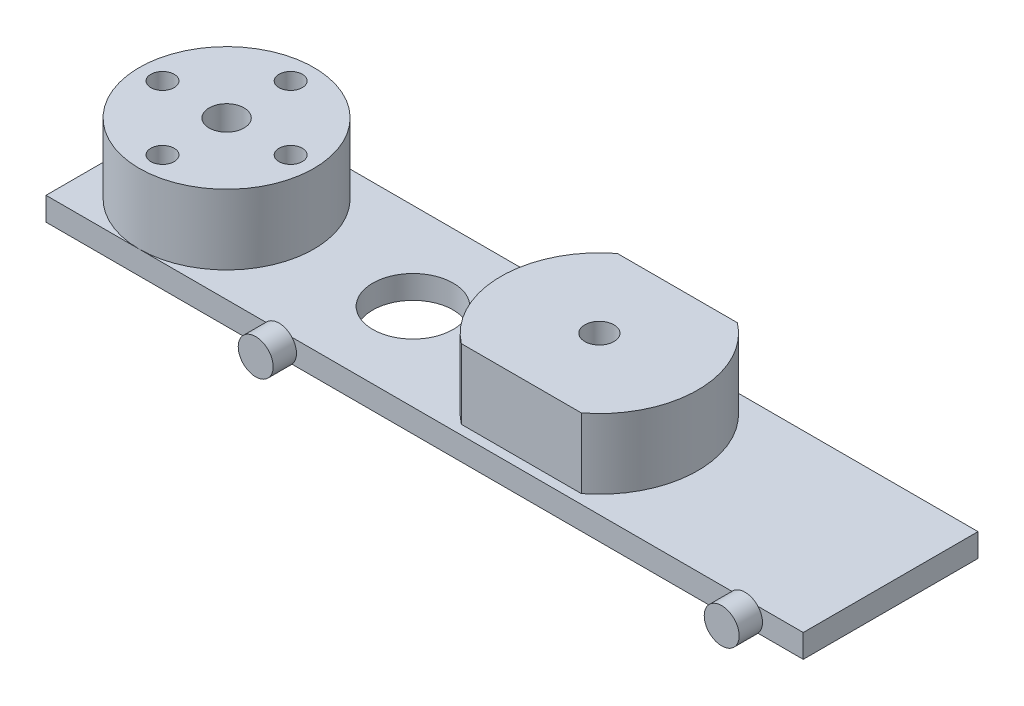
from build123d import *

# Parameters (mm, degrees)
SKETCH_1_W               = 65
SKETCH_1_H               = 15
EXTRUDE_1_DEPTH          = 2
SKETCH_2_R               = 1.25
SKETCH_2_R_2             = 3.45
SKETCH_2_R_3             = 1.5
SKETCH_2_R_4             = 1
CUT_EXTRUDE_1_DEPTH      = 2
SKETCH_4_R               = 1.5
EXTRUDE_2_DEPTH          = 2
SKETCH_5_R               = 7.5
SKETCH_5_R_2             = 7.2
EXTRUDE_3_DEPTH          = 6
SKETCH_5_8_R             = 1.25
SKETCH_5_8_R_2           = 7.2
EXTRUDE_4_DEPTH          = 6
CUT_EXTRUDE_2_DEPTH      = 3.5
CUT_EXTRUDE_2_DEPTH_BACK = 42.548164821
SKETCH_5_11_R            = 1.25
SKETCH_5_11_R_2          = 7.2
SKETCH_2_3_R             = 1.5
SKETCH_2_3_R_2           = 1
CUT_EXTRUDE_3_DEPTH      = 8


with BuildPart() as part:
    # 草图1 → 凸台-拉伸1 (new body)
    with BuildSketch(Plane(origin=(0, 0, 0), x_dir=(1, 0, 0), z_dir=(0, 1, 0))):
        with Locations((-7.5, 0)):
            Rectangle(SKETCH_1_W, SKETCH_1_H)
    extrude(amount=EXTRUDE_1_DEPTH)

    # 草图2 → 切除-拉伸1 (cut)
    with BuildSketch(Plane(origin=(0, 0, 0), x_dir=(1, 0, 0), z_dir=(0, 1, 0))):
        with Locations(Location((0, 0, 0), (0, 0, 270))):
            Circle(SKETCH_2_R)
        with Locations(Location((-16, 0, 0), (0, 0, 90))):
            Circle(SKETCH_2_R_2)
        with Locations(Location((-32, 0, 0), (0, 0, 270))):
            Circle(SKETCH_2_R_3)
        with Locations(Location((-26.5, 0, 0), (0, 0, 270))):
            Circle(SKETCH_2_R_4)
        with Locations(Location((-32, -5.5, 0), (0, 0, 270))):
            Circle(SKETCH_2_R_4)
        with Locations(Location((-37.5, 0, 0), (0, 0, 270))):
            Circle(SKETCH_2_R_4)
        with Locations(Location((-32, 5.5, 0), (0, 0, 270))):
            Circle(SKETCH_2_R_4)
    extrude(amount=CUT_EXTRUDE_1_DEPTH, mode=Mode.SUBTRACT)

    # 草图4 → 凸台-拉伸2 (add)
    with BuildSketch(Plane.XY.offset(7.5)):
        with Locations(Location((20, 1, 0), (0, 0, 221.810314896))):
            Circle(SKETCH_4_R)
        with Locations(Location((-20, 1, 0), (0, 0, 221.810314896))):
            Circle(SKETCH_4_R)
    extrude(amount=EXTRUDE_2_DEPTH)

    # 草图5 → 凸台-拉伸3 (add)
    # profile 1 of 2: a face of its own
    with BuildSketch(Plane(origin=(0, 2, 0), x_dir=(1, 0, 0), z_dir=(0, 1, 0))):
        with Locations(Location((-32, 0, 0), (0, 0, 270))):
            Circle(SKETCH_5_R)
        with Locations(Location((-32, 0, 0), (0, 0, 270))):
            Circle(SKETCH_5_R_2, mode=Mode.SUBTRACT)
    # profile 2 of 2: a face of its own
    with BuildSketch(Plane(origin=(0, 2, 0), x_dir=(1, 0, 0), z_dir=(0, 1, 0))):
        with BuildLine():
            Line((5.149029035, -6.7), (-5.149029035, -6.7))
            ThreePointArc((-5.149029035, -6.7), (-8.45, 0), (-5.149029035, 6.7))
            Line((-5.149029035, 6.7), (5.149029035, 6.7))
            ThreePointArc((5.149029035, 6.7), (8.45, 0), (5.149029035, -6.7))
        make_face()
        with BuildLine():
            Line((4.905354218, -6), (-4.905354218, -6))
            ThreePointArc((-4.905354218, -6), (-7.75, 0), (-4.905354218, 6))
            Line((-4.905354218, 6), (4.905354218, 6))
            ThreePointArc((4.905354218, 6), (7.75, 0), (4.905354218, -6))
        make_face(mode=Mode.SUBTRACT)
    extrude(amount=EXTRUDE_3_DEPTH)

    # 草图5<8> → 凸台-拉伸4 (add)
    # profile 1 of 2: a face of its own
    with BuildSketch(Plane(origin=(0, 2, 0), x_dir=(1, 0, 0), z_dir=(0, 1, 0))):
        with BuildLine():
            Line((4.905354218, -6), (-4.905354218, -6))
            ThreePointArc((-4.905354218, -6), (-7.75, 0), (-4.905354218, 6))
            Line((-4.905354218, 6), (4.905354218, 6))
            ThreePointArc((4.905354218, 6), (7.75, 0), (4.905354218, -6))
        make_face()
        with Locations(Location((0, 0, 0), (0, 0, 270))):
            Circle(SKETCH_5_8_R, mode=Mode.SUBTRACT)
    # profile 2 of 2: a face of its own
    with BuildSketch(Plane(origin=(0, 2, 0), x_dir=(1, 0, 0), z_dir=(0, 1, 0))):
        with Locations((-32, 0)):
            Circle(SKETCH_5_8_R_2)
    extrude(amount=EXTRUDE_4_DEPTH)

    # 草图5<11> → 切除-拉伸2 (cut, two sides: drawn at the far end of the back side and taken through both)
    # profile 1 of 2: a face of its own
    with BuildSketch(Plane(origin=(0, 2, 0), x_dir=(1, 0, 0), z_dir=(0, 1, 0)).offset(-CUT_EXTRUDE_2_DEPTH_BACK)):
        with BuildLine():
            Line((4.905354218, -6), (-4.905354218, -6))
            ThreePointArc((-4.905354218, -6), (-7.75, 0), (-4.905354218, 6))
            Line((-4.905354218, 6), (4.905354218, 6))
            ThreePointArc((4.905354218, 6), (7.75, 0), (4.905354218, -6))
        make_face()
        with Locations(Location((0, 0, 0), (0, 0, 270))):
            Circle(SKETCH_5_11_R, mode=Mode.SUBTRACT)
    # profile 2 of 2: a face of its own
    with BuildSketch(Plane(origin=(0, 2, 0), x_dir=(1, 0, 0), z_dir=(0, 1, 0)).offset(-CUT_EXTRUDE_2_DEPTH_BACK)):
        with Locations(Location((-32, 0, 0), (0, 0, 270))):
            Circle(SKETCH_5_11_R_2)
    extrude(amount=CUT_EXTRUDE_2_DEPTH + CUT_EXTRUDE_2_DEPTH_BACK, mode=Mode.SUBTRACT)

    # 草图2<3> → 切除-拉伸3 (cut)
    with BuildSketch(Plane(origin=(0, 0, 0), x_dir=(1, 0, 0), z_dir=(0, 1, 0))):
        with Locations(Location((-32, 0, 0), (0, 0, 270))):
            Circle(SKETCH_2_3_R)
        with Locations(Location((-32, 5.5, 0), (0, 0, 270))):
            Circle(SKETCH_2_3_R_2)
        with Locations(Location((-37.5, 0, 0), (0, 0, 270))):
            Circle(SKETCH_2_3_R_2)
        with Locations(Location((-32, -5.5, 0), (0, 0, 270))):
            Circle(SKETCH_2_3_R_2)
        with Locations(Location((-26.5, 0, 0), (0, 0, 270))):
            Circle(SKETCH_2_3_R_2)
    extrude(amount=CUT_EXTRUDE_3_DEPTH, mode=Mode.SUBTRACT)


solid = part.part
